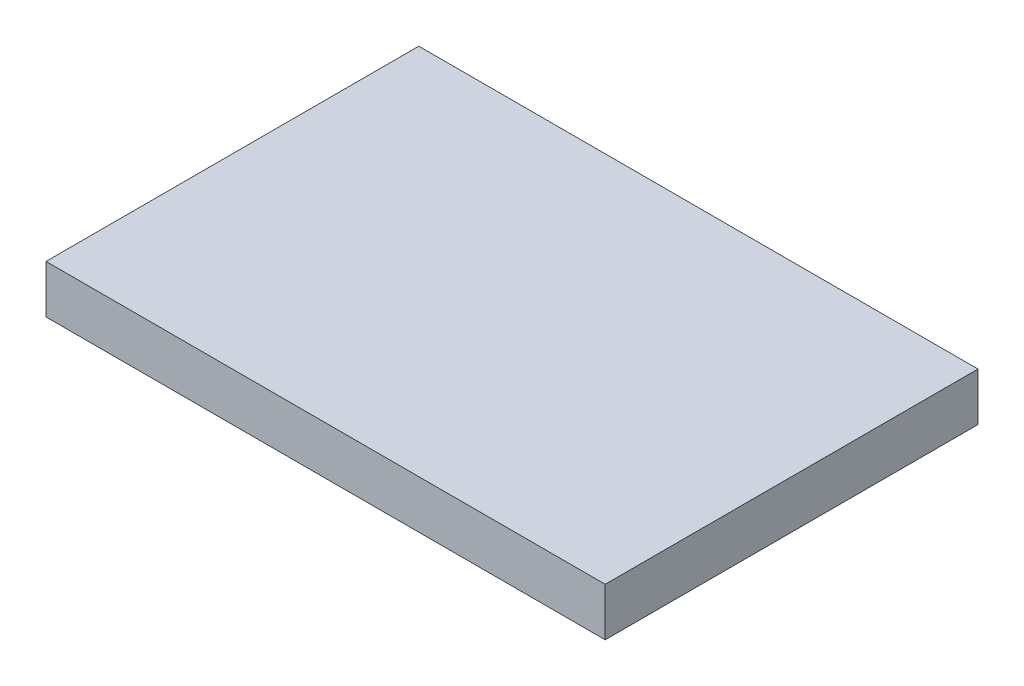
from build123d import *

# Parameters (mm, degrees)
SKETCH1_W           = 228.6
SKETCH1_H           = 12.7
BOSS_EXTRUDE1_DEPTH = 0.8
SKETCH6_W           = 9.3
SKETCH6_H           = 6.5
CUT_EXTRUDE5_DEPTH  = 229.953903657


with BuildPart() as part:
    # Sketch1 → Boss-Extrude1 (new body)
    with BuildSketch(Plane(origin=(0, 0, 0), x_dir=(1, 0, 0), z_dir=(0, 1, 0))):
        with Locations((114.3, -6.35)):
            Rectangle(SKETCH1_W, SKETCH1_H)
    extrude(amount=-BOSS_EXTRUDE1_DEPTH)

    # Sketch6 → Cut-Extrude5 (cut, through all)
    with BuildSketch(Plane.XZ.offset(0.8)):
        Polygon((9.3, 0), (228.6, 0), (228.6, 12.7), (9.3, 12.7), (9.3, 6.2), align=None)
        with Locations((4.65, 9.45)):
            Rectangle(SKETCH6_W, SKETCH6_H)
    extrude(amount=-CUT_EXTRUDE5_DEPTH, mode=Mode.SUBTRACT)


solid = part.part
